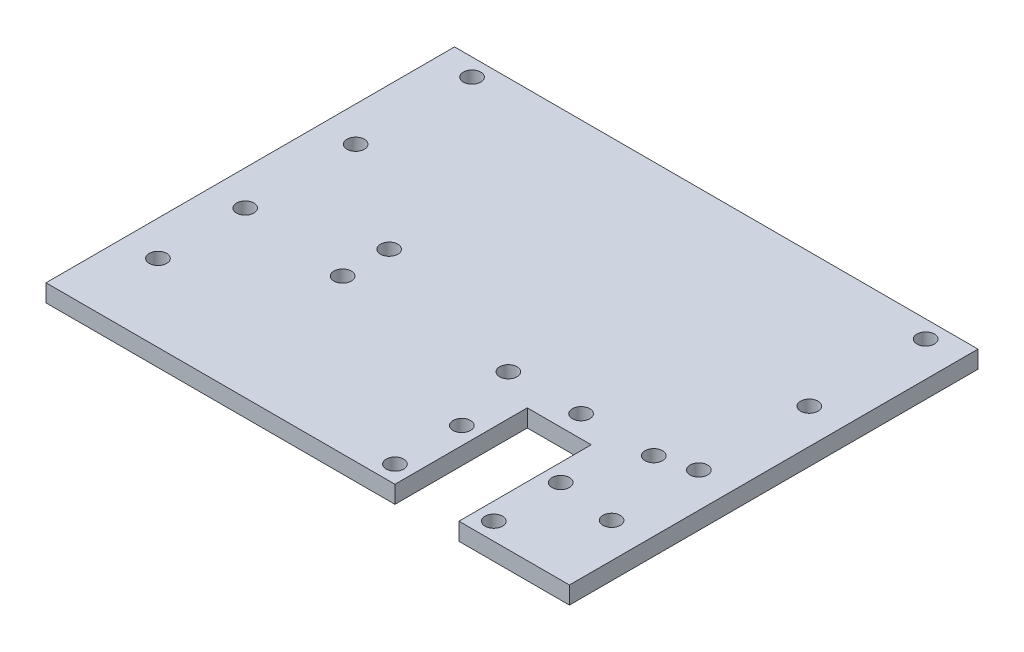
from build123d import *

# Parameters (mm, degrees)
BOSS_EXTRUDE1_DEPTH     = 3
SKETCH2_R               = 1.5
CUT_EXTRUDE1_DEPTH      = 65.778468645
SKETCH3_R               = 1.5
CUT_EXTRUDE2_DEPTH      = 65.778468645
SKETCH4_R               = 1.5
CUT_EXTRUDE3_DEPTH      = 65.778468645
SKETCH5_W               = 90
SKETCH5_H               = 22.75
CUT_EXTRUDE4_DEPTH      = 65.778468645
CUT_EXTRUDE5_DEPTH      = 65.778468645
CUT_EXTRUDE5_DEPTH_BACK = 65.778468645
SKETCH6_R               = 1.5
SKETCH7_R               = 1.5
CUT_EXTRUDE6_DEPTH      = 65.778468645
SKETCH8_R               = 1.5
CUT_EXTRUDE7_DEPTH      = 65.778468645
SKETCH9_R               = 1.5
CUT_EXTRUDE8_DEPTH      = 65.778468645


with BuildPart() as part:
    # Sketch1 → Boss-Extrude1 (new body)
    with BuildSketch(Plane(origin=(0, 0, 0), x_dir=(1, 0, 0), z_dir=(0, 1, 0))):
        Polygon((-45, 46.5), (-45, -46.5), (15, -46.5), (15, -1), (26, -1), (26, -46.5), (45, -46.5), (45, 46.5), align=None)
    extrude(amount=BOSS_EXTRUDE1_DEPTH)

    # Sketch2 → Cut-Extrude1 (cut, through all)
    with BuildSketch(Plane(origin=(0, 3, 0), x_dir=(1, 0, 0), z_dir=(0, 1, 0))):
        with Locations(Location((39, 4.5, 0), (0, 0, 270))):
            Circle(SKETCH2_R)
        with Locations(Location((39, -10.5, 0), (0, 0, 270))):
            Circle(SKETCH2_R)
        with Locations(Location((-39, 4.5, 0), (0, 0, 270))):
            Circle(SKETCH2_R)
        with Locations(Location((-39, -10.5, 0), (0, 0, 270))):
            Circle(SKETCH2_R)
    extrude(amount=-CUT_EXTRUDE1_DEPTH, mode=Mode.SUBTRACT)

    # Sketch3 → Cut-Extrude2 (cut, through all)
    with BuildSketch(Plane(origin=(0, 3, 0), x_dir=(1, 0, 0), z_dir=(0, 1, 0))):
        with Locations(Location((29, -20.75, 0), (0, 0, 270))):
            Circle(SKETCH3_R)
        with Locations(Location((12, -20.75, 0), (0, 0, 270))):
            Circle(SKETCH3_R)
    extrude(amount=-CUT_EXTRUDE2_DEPTH, mode=Mode.SUBTRACT)

    # Sketch4 → Cut-Extrude3 (cut, through all)
    with BuildSketch(Plane(origin=(0, 3, 0), x_dir=(1, 0, 0), z_dir=(0, 1, 0))):
        with Locations(Location((12, -9.25, 0), (0, 0, 270))):
            Circle(SKETCH4_R)
        with Locations(Location((29, -9.25, 0), (0, 0, 270))):
            Circle(SKETCH4_R)
    extrude(amount=-CUT_EXTRUDE3_DEPTH, mode=Mode.SUBTRACT)

    # Sketch5 → Cut-Extrude4 (cut, through all)
    with BuildSketch(Plane(origin=(0, 3, 0), x_dir=(1, 0, 0), z_dir=(0, 1, 0))):
        with Locations((0, -35.125)):
            Rectangle(SKETCH5_W, SKETCH5_H)
    extrude(amount=-CUT_EXTRUDE4_DEPTH, mode=Mode.SUBTRACT)

    # Sketch6 → Cut-Extrude5 (cut, two sides: drawn at the far end of the back side and taken through both)
    with BuildSketch(Plane(origin=(0, 3, 0), x_dir=(1, 0, 0), z_dir=(0, 1, 0)).offset(-CUT_EXTRUDE5_DEPTH_BACK)):
        with Locations(Location((20.5, 2.75, 0), (0, 0, 270))):
            Circle(SKETCH6_R)
        with Locations(Location((33, 2.75, 0), (0, 0, 270))):
            Circle(SKETCH6_R)
        with Locations(Location((8, 2.75, 0), (0, 0, 270))):
            Circle(SKETCH6_R)
    extrude(amount=CUT_EXTRUDE5_DEPTH + CUT_EXTRUDE5_DEPTH_BACK, mode=Mode.SUBTRACT)

    # Sketch7 → Cut-Extrude6 (cut, through all)
    with BuildSketch(Plane(origin=(0, 3, 0), x_dir=(1, 0, 0), z_dir=(0, 1, 0))):
        with Locations(Location((-39, 23.5, 0), (0, 0, 270))):
            Circle(SKETCH7_R)
        with Locations(Location((39, 23.5, 0), (0, 0, 270))):
            Circle(SKETCH7_R)
    extrude(amount=-CUT_EXTRUDE6_DEPTH, mode=Mode.SUBTRACT)

    # Sketch8 → Cut-Extrude7 (cut, through all)
    with BuildSketch(Plane(origin=(0, 3, 0), x_dir=(1, 0, 0), z_dir=(0, 1, 0))):
        with Locations(Location((-39, 43.5, 0), (0, 0, 270))):
            Circle(SKETCH8_R)
        with Locations(Location((39, 43.5, 0), (0, 0, 270))):
            Circle(SKETCH8_R)
    extrude(amount=-CUT_EXTRUDE7_DEPTH, mode=Mode.SUBTRACT)

    # Sketch9 → Cut-Extrude8 (cut, through all)
    with BuildSketch(Plane(origin=(0, 3, 0), x_dir=(1, 0, 0), z_dir=(0, 1, 0))):
        with Locations(Location((-20.5, 2.75, 0), (0, 0, 270))):
            Circle(SKETCH9_R)
        with Locations(Location((-20.5, 10.75, 0), (0, 0, 270))):
            Circle(SKETCH9_R)
    extrude(amount=-CUT_EXTRUDE8_DEPTH, mode=Mode.SUBTRACT)


solid = part.part
